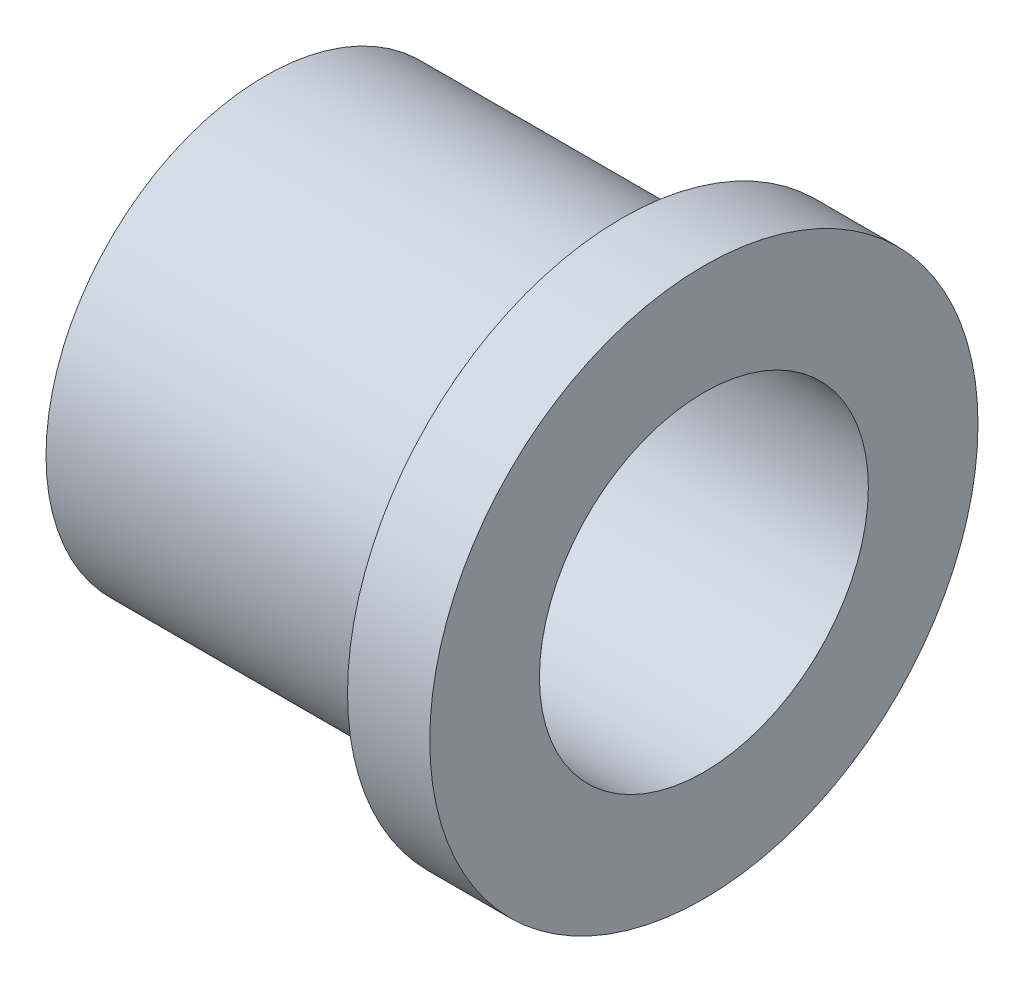
from build123d import *


with BuildPart() as part:
    # Sketch1 → Revolve1 (revolve)
    with BuildSketch(Plane.XY, mode=Mode.PRIVATE) as revolve1_sk:
        Polygon((-25.4, 12.7), (-4.7625, 12.7), (-4.7625, 15.875), (0, 15.875), (0, 9.525), (-25.4, 9.525), align=None)
    revolve(revolve1_sk.sketch.rotate(Axis((0, 0, 0), (1, 0, 0)), 90), axis=Axis((0, 0, 0), (1, 0, 0)))


solid = part.part
